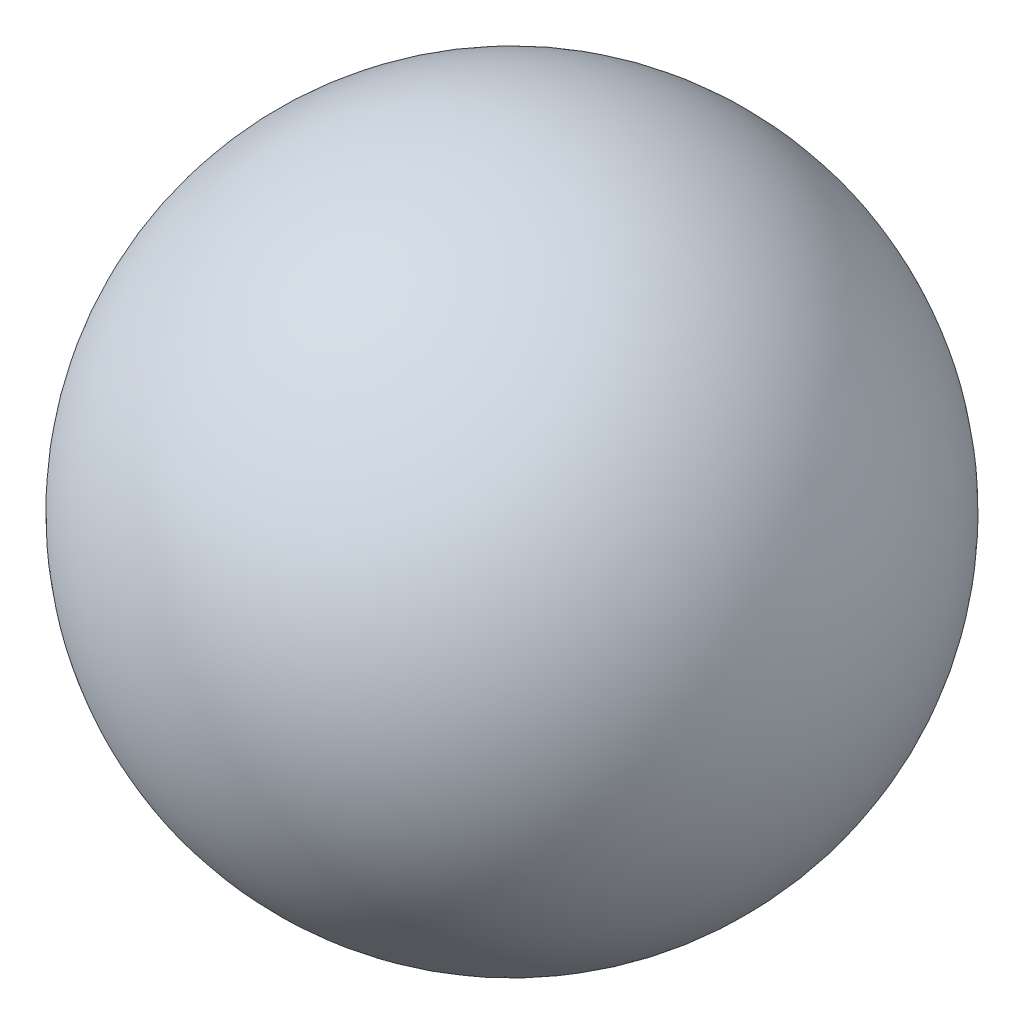
from build123d import *


with BuildPart() as part:
    # 草图1 → 旋转1 (revolve)
    with BuildSketch(Plane(origin=(0, 0, 0), x_dir=(1, 0, 0), z_dir=(0, 1, 0))):
        with BuildLine():
            Line((0, 7.3), (0, -7.3))
            ThreePointArc((0, -7.3), (7.3, 0), (0, 7.3))
        make_face()
    revolve(axis=Axis((0, 0, -7.3), (0, 0, 1)))


solid = part.part
